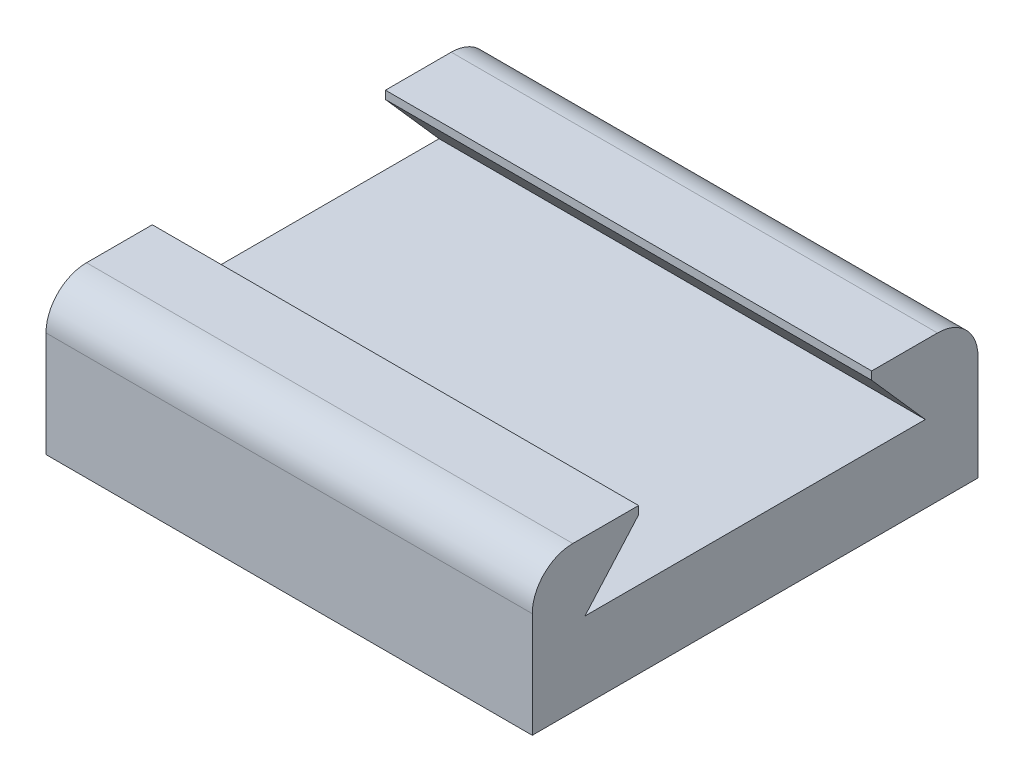
from build123d import *

# Parameters (mm, degrees)
SKETCH1_W           = 12
SKETCH1_H           = 11
BOSS_EXTRUDE1_DEPTH = 1.6
SKETCH2_W           = 12
SKETCH2_H           = 11
BOSS_EXTRUDE2_DEPTH = 2
CUT_EXTRUDE1_DEPTH  = 17.672132437
CUT_EXTRUDE2_DEPTH  = 17.672132437
FILLET1_R           = 1


with BuildPart() as part:
    # Sketch1 → Boss-Extrude1 (new body)
    with BuildSketch(Plane(origin=(0, 0, 0), x_dir=(1, 0, 0), z_dir=(0, 1, 0))):
        with Locations((6, -5.5)):
            Rectangle(SKETCH1_W, SKETCH1_H)
    extrude(amount=BOSS_EXTRUDE1_DEPTH)

    # Sketch2 → Boss-Extrude2 (add)
    with BuildSketch(Plane(origin=(0, 1.6, 0), x_dir=(1, 0, 0), z_dir=(0, 1, 0))):
        with Locations((6, -5.5)):
            Rectangle(SKETCH2_W, SKETCH2_H)
    extrude(amount=BOSS_EXTRUDE2_DEPTH)

    # Sketch3 → Cut-Extrude1 (cut, through all)
    with BuildSketch(Plane(origin=(12, 0, 0), x_dir=(0, 0, -1), z_dir=(1, 0, 0))):
        Polygon((-9.7, 1.9), (-8.2, 3.6), (-2.8, 3.6), (-1.3, 1.9), align=None)
    extrude(amount=-CUT_EXTRUDE1_DEPTH, mode=Mode.SUBTRACT)

    # Sketch4 → Cut-Extrude2 (cut, through all)
    with BuildSketch(Plane(origin=(12, 0, 0), x_dir=(0, 0, -1), z_dir=(1, 0, 0))):
        Polygon((-8.376470588, 3.4), (-8.376470588, 3.6), (-8.2, 3.6), align=None)
        Polygon((-2.623529412, 3.4), (-2.623529412, 3.6), (-2.8, 3.6), align=None)
    extrude(amount=-CUT_EXTRUDE2_DEPTH, mode=Mode.SUBTRACT)

    # Fillet1
    fillet1_edges = [part.edges().sort_by_distance(p)[0] for p in [
        (6, 3.6, 11),
        (6, 3.6, 0),
    ]]
    fillet(fillet1_edges, radius=FILLET1_R)


solid = part.part
